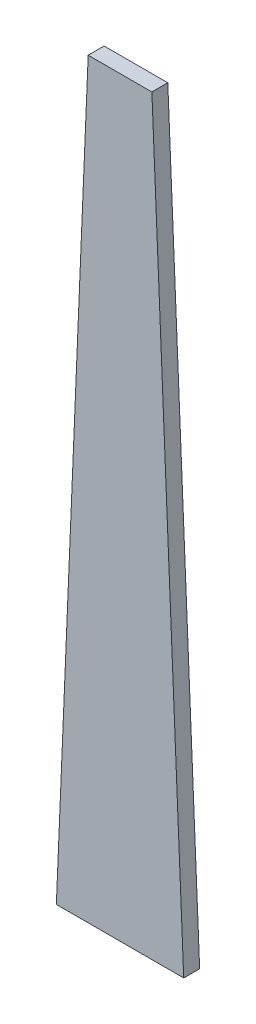
from build123d import *

# Parameters (mm, degrees)
BOSS_EXTRUDE1_DEPTH = 6.35


with BuildPart() as part:
    # Sketch1 → Boss-Extrude1 (new body)
    with BuildSketch(Plane.XY):
        Polygon((-25.4, 0), (25.4, 0), (12.7, 299.72), (-12.7, 299.72), align=None)
    extrude(amount=BOSS_EXTRUDE1_DEPTH)


solid = part.part
